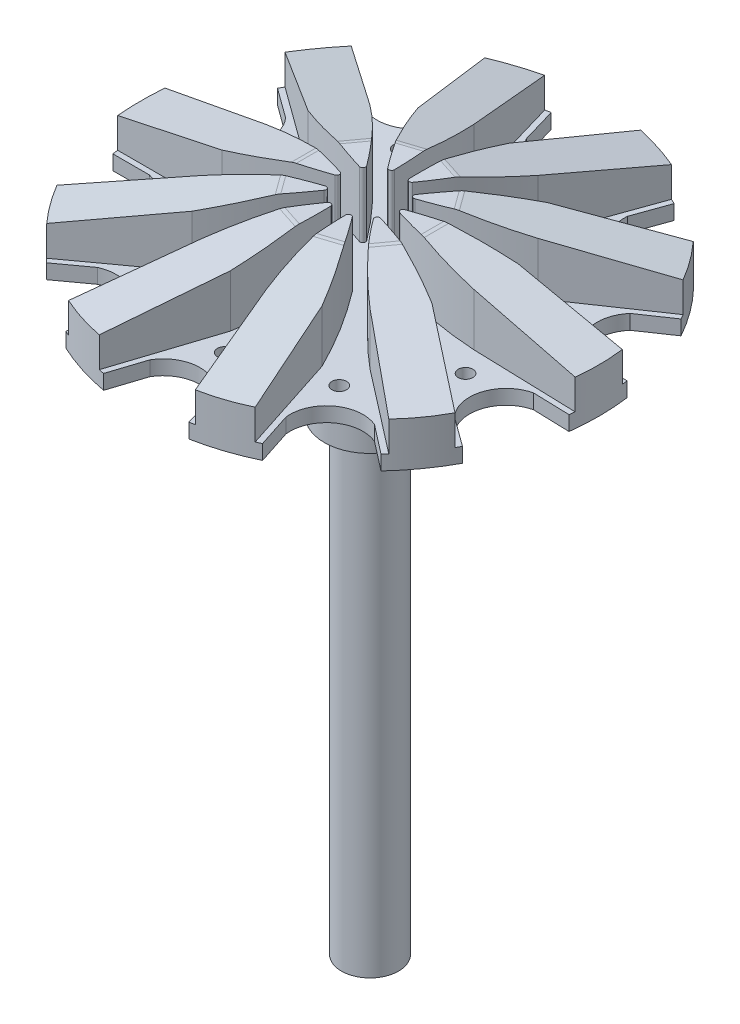
from build123d import *

# Parameters (mm, degrees)
SKETCH1_R                    = 41.91
IMPELLER_PLATE_DEPTH         = 2.032
FIRST_VANE_DEPTH             = 10.16
VANE_ANGLE_CUT_DEPTH         = 61.51066901
VANE_ANGLE_CUT_DEPTH_BACK    = 61.51066901
VANE_PATTERN_COUNT           = 10
SKETCH10_R                   = 1.5875
BALANCE_CUTS_DEPTH           = 10.16
SKETCH11_R                   = 6.35
BOSS_EXTRUDE1_DEPTH          = 15.846806
FILLET4_R                    = 6.35
SKETCH14_R                   = 3.96875
BOSS_EXTRUDE2_DEPTH          = 64.7065
SKETCH15_W                   = 13.074355289
SKETCH15_H                   = 86.690038672
SKETCH16_R                   = 9.652
VANE_FACE_PARALLEL_CUT_DEPTH = 0.5842
FILLET5_R                    = 10.16
CUT_EXTRUDE2_REACH           = 109.374
SKETCH17_R                   = 38.1
SKETCH17_R_2                 = 31.75
CUT_EXTRUDE3_START           = 95.0024349
CUT_EXTRUDE3_DEPTH           = 97.5424349
CIRPATTERN3_COUNT            = 10
SKETCH19_R                   = 1.016
CUT_EXTRUDE4_DEPTH           = 2.032
CIRPATTERN4_COUNT            = 10
FILLET7_R                    = 0.381
SKETCH20_R                   = 9.144
CUT_EXTRUDE5_DEPTH           = 1.283119283
FILLET8_R                    = 2.54


with BuildPart() as part:
    # Sketch1 → Impeller Plate (new body)
    with BuildSketch(Plane(origin=(0, 0, 0), x_dir=(1, 0, 0), z_dir=(0, 1, 0))):
        with Locations(Location((0, 0, 0), (0, 0, 270))):
            Circle(SKETCH1_R)
    extrude(amount=IMPELLER_PLATE_DEPTH)

    # Sketch8 → First Vane (add)
    with BuildSketch(Plane(origin=(0, 2.032, 0), x_dir=(1, 0, 0), z_dir=(0, 1, 0))):
        with BuildLine():
            Line((41.768433397, 3.441812249), (17.116970715, 3.441812249))
            ThreePointArc((17.116970715, 3.441812249), (10.195032205, 2.051802513), (3.450260899, -0.03468253))
            ThreePointArc((3.450260899, -0.03468253), (10.193363736, -1.83103124), (17.116970715, -2.702794368))
            Line((17.116970715, -2.702794368), (41.768433397, -3.441812249))
            ThreePointArc((41.768433397, -3.441812249), (41.91, 0), (41.768433397, 3.441812249))
        make_face()
    extrude(amount=FIRST_VANE_DEPTH)

    # Sketch9 → Vane Angle Cut (cut, two sides: drawn at the far end of the back side and taken through both)
    with BuildSketch(Plane.XY.offset(-VANE_ANGLE_CUT_DEPTH_BACK)):
        Polygon((3.450260899, 12.192), (41.91, 12.192), (41.91, 4.017130094), align=None)
    extrude(amount=VANE_ANGLE_CUT_DEPTH + VANE_ANGLE_CUT_DEPTH_BACK, mode=Mode.SUBTRACT)


with BuildPart() as vane_pattern_1:
    # Vane Pattern: pattern copy
    add(part.part.rotate(Axis((0, 0, 0), (0, 1, 0)), 1 * 360 / VANE_PATTERN_COUNT))


with BuildPart() as vane_pattern_2:
    # Vane Pattern: pattern copy
    add(part.part.rotate(Axis((0, 0, 0), (0, 1, 0)), 2 * 360 / VANE_PATTERN_COUNT))


with BuildPart() as vane_pattern_3:
    # Vane Pattern: pattern copy
    add(part.part.rotate(Axis((0, 0, 0), (0, 1, 0)), 3 * 360 / VANE_PATTERN_COUNT))


with BuildPart() as vane_pattern_4:
    # Vane Pattern: pattern copy
    add(part.part.rotate(Axis((0, 0, 0), (0, 1, 0)), 4 * 360 / VANE_PATTERN_COUNT))


with BuildPart() as vane_pattern_5:
    # Vane Pattern: pattern copy
    add(part.part.rotate(Axis((0, 0, 0), (0, 1, 0)), 5 * 360 / VANE_PATTERN_COUNT))


with BuildPart() as vane_pattern_6:
    # Vane Pattern: pattern copy
    add(part.part.rotate(Axis((0, 0, 0), (0, 1, 0)), 6 * 360 / VANE_PATTERN_COUNT))


with BuildPart() as vane_pattern_7:
    # Vane Pattern: pattern copy
    add(part.part.rotate(Axis((0, 0, 0), (0, 1, 0)), 7 * 360 / VANE_PATTERN_COUNT))


with BuildPart() as vane_pattern_8:
    # Vane Pattern: pattern copy
    add(part.part.rotate(Axis((0, 0, 0), (0, 1, 0)), 8 * 360 / VANE_PATTERN_COUNT))


with BuildPart() as vane_pattern_9:
    # Vane Pattern: pattern copy
    add(part.part.rotate(Axis((0, 0, 0), (0, 1, 0)), 9 * 360 / VANE_PATTERN_COUNT))


with BuildPart() as balance_cuts_tool:
    # Sketch10 → Balance Cuts (new body)
    with BuildSketch(Plane(origin=(0, 2.032, 0), x_dir=(1, 0, 0), z_dir=(0, 1, 0))):
        with Locations(Location((-12.739074523, -17.697795014, 0), (0, 0, 270))):
            Circle(SKETCH10_R)
        with BuildLine():
            Line((-31.26396456, -27.910797552), (-24.438938581, -22.952125923))
            ThreePointArc((-24.438938581, -22.952125923), (-16.841308888, -23.396527612), (-14.058143437, -30.479991446))
            Line((-14.058143437, -30.479991446), (-16.882044385, -38.359414456))
            ThreePointArc((-16.882044385, -38.359414456), (-24.75533858, -34.074299656), (-31.26396456, -27.910797552))
        make_face()
    extrude(amount=-BALANCE_CUTS_DEPTH)


with BuildPart() as part_1:
    add(part.part)

    # Balance Cuts: cut by balance_cuts_tool
    add(balance_cuts_tool.part, mode=Mode.SUBTRACT)



with BuildPart() as vane_pattern_1_1:
    add(vane_pattern_1.part)

    # Balance Cuts: cut by balance_cuts_tool
    add(balance_cuts_tool.part, mode=Mode.SUBTRACT)


with BuildPart() as vane_pattern_2_1:
    add(vane_pattern_2.part)

    # Balance Cuts: cut by balance_cuts_tool
    add(balance_cuts_tool.part, mode=Mode.SUBTRACT)


with BuildPart() as vane_pattern_3_1:
    add(vane_pattern_3.part)

    # Balance Cuts: cut by balance_cuts_tool
    add(balance_cuts_tool.part, mode=Mode.SUBTRACT)


with BuildPart() as vane_pattern_4_1:
    add(vane_pattern_4.part)

    # Balance Cuts: cut by balance_cuts_tool
    add(balance_cuts_tool.part, mode=Mode.SUBTRACT)


with BuildPart() as vane_pattern_5_1:
    add(vane_pattern_5.part)

    # Balance Cuts: cut by balance_cuts_tool
    add(balance_cuts_tool.part, mode=Mode.SUBTRACT)


with BuildPart() as vane_pattern_6_1:
    add(vane_pattern_6.part)

    # Balance Cuts: cut by balance_cuts_tool
    add(balance_cuts_tool.part, mode=Mode.SUBTRACT)


with BuildPart() as vane_pattern_7_1:
    add(vane_pattern_7.part)

    # Balance Cuts: cut by balance_cuts_tool
    add(balance_cuts_tool.part, mode=Mode.SUBTRACT)


with BuildPart() as part_2:
    add(part_1.part)

    add(vane_pattern_1_1.part)  # Boss-Extrude1 merges Vane Pattern_1

    add(vane_pattern_2_1.part)  # Boss-Extrude1 merges Vane Pattern_2

    add(vane_pattern_3_1.part)  # Boss-Extrude1 merges Vane Pattern_3

    add(vane_pattern_4_1.part)  # Boss-Extrude1 merges Vane Pattern_4

    add(vane_pattern_5_1.part)  # Boss-Extrude1 merges Vane Pattern_5

    add(vane_pattern_6_1.part)  # Boss-Extrude1 merges Vane Pattern_6

    add(vane_pattern_7_1.part)  # Boss-Extrude1 merges Vane Pattern_7

    add(vane_pattern_8.part)  # Boss-Extrude1 merges Vane Pattern_8

    add(vane_pattern_9.part)  # Boss-Extrude1 merges Vane Pattern_9
    # Sketch11 → Boss-Extrude1 (add)
    with BuildSketch(Plane.XZ):
        with Locations(Location((0, 0, 0), (0, 0, 90))):
            Circle(SKETCH11_R)
    extrude(amount=BOSS_EXTRUDE1_DEPTH)

    # Fillet4
    fillet4_edges = [part_2.edges().sort_by_distance(p)[0] for p in [
        (0, 0, -6.35),
    ]]
    fillet(fillet4_edges, radius=FILLET4_R)

    # Sketch14 → Boss-Extrude2 (add)
    with BuildSketch(Plane(origin=(0, -15.846806, 0), x_dir=(-1, 0, 0), z_dir=(0, -1, 0))):
        with Locations(Location((0, 0, 0), (0, 0, 90))):
            Circle(SKETCH14_R)
    extrude(amount=BOSS_EXTRUDE2_DEPTH)

    # Sketch15 → Diameter Trim (revolve, cut)
    with BuildSketch(Plane(origin=(0, 0, 0), x_dir=(0, 0, -1), z_dir=(1, 0, 0))):
        with Locations((-44.637177644, -28.655221466)):
            Rectangle(SKETCH15_W, SKETCH15_H)
    revolve(axis=Axis((0, 0, 0), (0, -1, 0)), mode=Mode.SUBTRACT)

    # Sketch16 → Vane Face Parallel Cut (cut)
    with BuildSketch(Plane(origin=(0, 12.322890518, 0), x_dir=(1, 0, 0), z_dir=(0, 1, 0))):
        Circle(SKETCH16_R)
    extrude(amount=-VANE_FACE_PARALLEL_CUT_DEPTH, mode=Mode.SUBTRACT)

    # Fillet5
    fillet5_edges = [part_2.edges().sort_by_distance(p)[0] for p in [
        (-5.582914337, 11.738690518, -0.001075617),
        (-4.517304809, 11.738690518, 3.28068452),
        (-1.726238381, 11.738690518, 5.309334676),
        (1.724192435, 11.738690518, 5.309999444),
        (4.516040345, 11.738690518, 3.282424905),
        (5.582914337, 11.738690518, 0.001075617),
        (4.517304809, 11.738690518, -3.28068452),
        (1.726238381, 11.738690518, -5.309334676),
        (-1.724192435, 11.738690518, -5.309999444),
        (-4.516040345, 11.738690518, -3.282424905),
    ]]
    fillet(fillet5_edges, radius=FILLET5_R)

    # Cut-Extrude2: up to this face of the body (flat: up to its plane)
    cut_extrude2_end = Plane(part_2.part.faces().sort_by_distance((0, 0, -37.022369265))[0])
    # Sketch17 → Cut-Extrude2 (cut, up to the picked face)
    with BuildSketch(Plane(origin=(0, 12.322890518, 0), x_dir=(1, 0, 0), z_dir=(0, 1, 0)), mode=Mode.PRIVATE) as cut_extrude2_sk1:
        Circle(SKETCH17_R)
        with Locations(Location((0, 0, 0), (0, 0, 270))):
            Circle(SKETCH17_R_2, mode=Mode.SUBTRACT)
    cut_extrude2_tool1 = split(extrude(cut_extrude2_sk1.sketch, amount=-CUT_EXTRUDE2_REACH, mode=Mode.PRIVATE), bisect_by=cut_extrude2_end, keep=Keep.BOTH, mode=Mode.PRIVATE)
    add(cut_extrude2_tool1.solids().sort_by(Axis((-37.022369, 12.322891, 0), (0, -1, 0)))[0], mode=Mode.SUBTRACT)

    # Sketch18 → Cut-Extrude3 (cut)
    with BuildSketch(Plane(origin=(0, 2.032, 0), x_dir=(1, 0, 0), z_dir=(0, 1, 0)).offset(CUT_EXTRUDE3_START)):
        with BuildLine():
            Line((-18.879399626, -18.912884436), (-22.989205958, -21.898833518))
            ThreePointArc((-22.989205958, -21.898833518), (-18.536674251, -25.777009285), (-13.443025108, -28.763650254))
            Line((-13.443025108, -28.763650254), (-11.729150826, -23.981492274))
            ThreePointArc((-11.729150826, -23.981492274), (-13.852412895, -19.399056557), (-18.879399626, -18.912884436))
        make_face()
    cut_extrude3 = extrude(amount=-CUT_EXTRUDE3_DEPTH, mode=Mode.SUBTRACT)

    # CirPattern3: Cut-Extrude3 ×10 about axis
    cirpattern3_axis = Axis((0, 0, 0), (0, 1, 0))
    for i in range(1, CIRPATTERN3_COUNT):
        add(cut_extrude3.rotate(cirpattern3_axis, i * 360 / CIRPATTERN3_COUNT), mode=Mode.SUBTRACT)

    # Sketch19 → Cut-Extrude4 (cut)
    with BuildSketch(Plane(origin=(0, 2.032, 0), x_dir=(1, 0, 0), z_dir=(0, 1, 0))):
        with Locations(Location((-11.808470495, -16.536699325, 0), (0, 0, 270))):
            Circle(SKETCH19_R)
    cut_extrude4 = extrude(amount=-CUT_EXTRUDE4_DEPTH, mode=Mode.SUBTRACT)

    # CirPattern4: Cut-Extrude4 ×10 about axis
    cirpattern4_axis = Axis((0, 0, 0), (0, 1, 0))
    for i in range(1, CIRPATTERN4_COUNT):
        add(cut_extrude4.rotate(cirpattern4_axis, i * 360 / CIRPATTERN4_COUNT), mode=Mode.SUBTRACT)

    # Fillet7
    fillet7_edges = [part_2.edges().sort_by_distance(p)[0] for p in [
        (2.770933823, 6.885345259, 2.056071229),
        (1.033204207, 6.885345259, 3.292110602),
        (-1.099174299, 6.885345259, 3.27067562),
        (-2.811705582, 6.885345259, 1.999953717),
        (-3.450260899, 6.885345259, -0.03468253),
        (-2.770933823, 6.885345259, -2.056071229),
        (-1.033204207, 6.885345259, -3.292110602),
        (1.099174299, 6.885345259, -3.27067562),
        (2.811705582, 6.885345259, -1.999953717),
        (3.450260899, 6.885345259, 0.03468253),
    ]]
    fillet(fillet7_edges, radius=FILLET7_R)

    # Sketch20 → Cut-Extrude5 (cut)
    with BuildSketch(Plane(origin=(0, 12.322890518, 0), x_dir=(1, 0, 0), z_dir=(0, 1, 0))):
        Circle(SKETCH20_R)
    extrude(amount=-CUT_EXTRUDE5_DEPTH, mode=Mode.SUBTRACT)

    # Fillet8
    fillet8_edges = [part_2.edges().sort_by_distance(p)[0] for p in [
        (-2.671807213, 11.039771235, 8.459473298),
        (-7.133891088, 11.039771235, 5.273408785),
        (-8.87107104, 11.039771235, 0.073081352),
        (-7.21980337, 11.039771235, -5.155160673),
        (-2.810816206, 11.039771235, -8.414306539),
        (2.671807213, 11.039771235, -8.459473298),
        (7.133891088, 11.039771235, -5.273408785),
        (8.87107104, 11.039771235, -0.073081352),
        (7.21980337, 11.039771235, 5.155160673),
        (2.810816206, 11.039771235, 8.414306539),
    ]]
    fillet(fillet8_edges, radius=FILLET8_R)


solid = part_2.part
